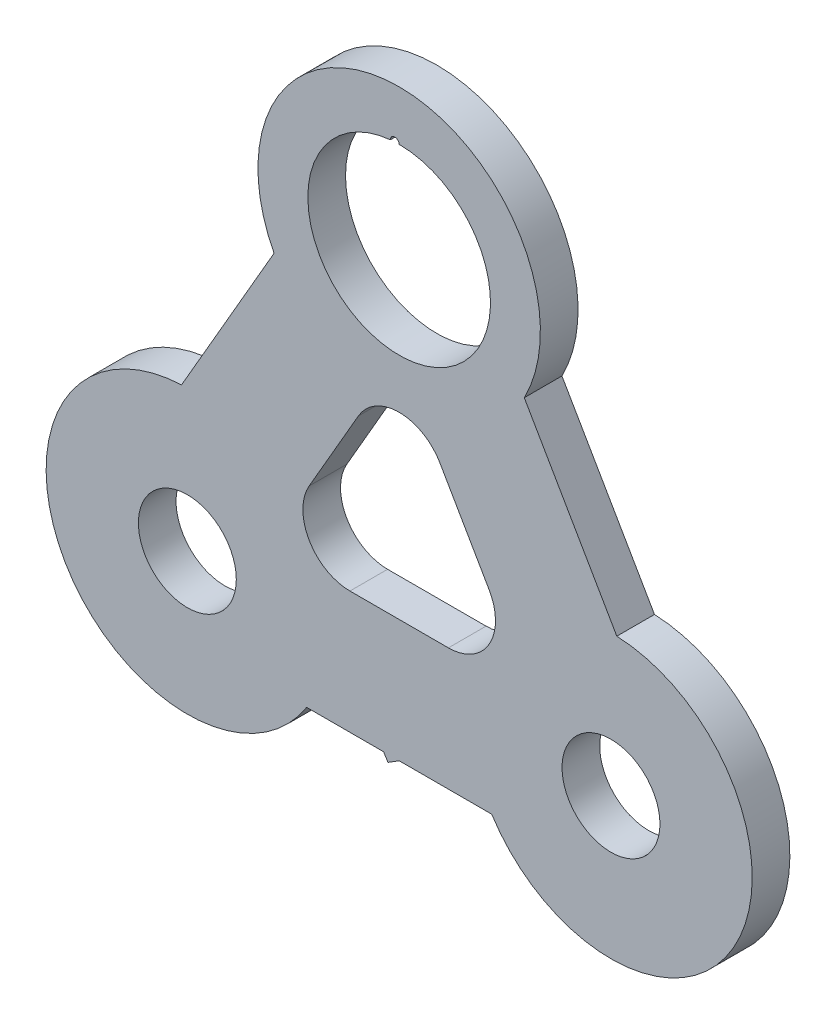
from build123d import *

# Parameters (mm, degrees)
SKETCH_1_R          = 5.2
EXTRUDE_1_DEPTH     = 4
CUT_EXTRUDE_1_DEPTH = 4


with BuildPart() as part:
    # 草图1 → 凸台-拉伸1 (new body)
    with BuildSketch(Plane.XY):
        with BuildLine():
            Line((-18.494622549, 4.742999843), (-23.409453688, -3.769737399))
            ThreePointArc((-23.409453688, -3.769737399), (-35.781809628, -26.257000157), (-10.121090849, -26.785856986))
            Line((-10.121090849, -26.785856986), (-1.94731163, -26.785856986))
            Line((-1.94731163, -26.785856986), (-1.47982289, -27.531216606))
            Line((-1.47982289, -27.531216606), (-0.291428571, -26.785856986))
            Line((-0.291428571, -26.785856986), (9.538233706, -26.785856986))
            ThreePointArc((9.538233706, -26.785856986), (35.198952485, -26.257000157), (22.826596545, -3.769737399))
            Line((22.826596545, -3.769737399), (17.911765406, 4.742999843))
            Line((17.911765406, 4.742999843), (12.996934268, 13.255737086))
            ThreePointArc((12.996934268, 13.255737086), (-0.291428571, 35.214143014), (-13.579791411, 13.255737086))
            Line((-13.579791411, 13.255737086), (-18.494622549, 4.742999843))
        make_face()
        with Locations((-0.291428571, 20.214143014)):
            Circle(SKETCH_1_R, mode=Mode.SUBTRACT)
        with Locations((22.208571429, -18.757000157)):
            Circle(SKETCH_1_R, mode=Mode.SUBTRACT)
        with Locations((-22.791428571, -18.757000157)):
            Circle(SKETCH_1_R, mode=Mode.SUBTRACT)
        with BuildLine():
            Line((9.268171867, -6.285856986), (4.038698447, 2.771856673))
            ThreePointArc((4.038698447, 2.771856673), (-0.291428571, 5.271856673), (-4.62155559, 2.771856673))
            Line((-4.62155559, 2.771856673), (-9.85102901, -6.285856986))
            ThreePointArc((-9.85102901, -6.285856986), (-9.85102901, -11.285856986), (-5.520901991, -13.785856986))
            Line((-5.520901991, -13.785856986), (4.938044848, -13.785856986))
            ThreePointArc((4.938044848, -13.785856986), (9.268171867, -11.285856986), (9.268171867, -6.285856986))
        make_face(mode=Mode.SUBTRACT)
    extrude(amount=EXTRUDE_1_DEPTH)

    # 草图2 → 切除-拉伸1 (cut)
    with BuildSketch(Plane.XY.offset(4)):
        with BuildLine():
            ThreePointArc((-0.291428571, 29.914143014), (-0.77677081, 30.355150727), (-1.217778524, 29.869808489))
            ThreePointArc((-1.217778524, 29.869808489), (0.172276557, 10.525232985), (-0.291428571, 29.914143014))
        make_face()
    extrude(amount=-CUT_EXTRUDE_1_DEPTH, mode=Mode.SUBTRACT)


solid = part.part
